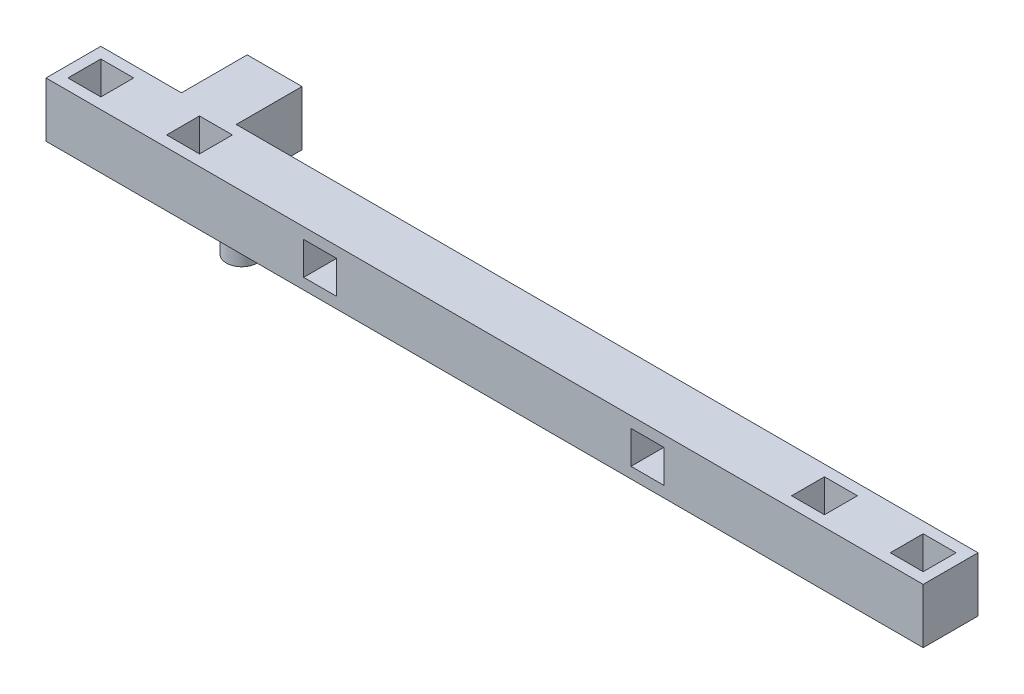
from build123d import *

# Parameters (mm, degrees)
SKETCH1_W           = 80
SKETCH1_H           = 5
SKETCH1_W_2         = 3
SKETCH1_H_2         = 3
BOSS_EXTRUDE1_DEPTH = 5
SKETCH2_W           = 3
SKETCH2_H           = 3
CUT_EXTRUDE1_DEPTH  = 5
SKETCH3_W           = 5
SKETCH3_H           = 5
BOSS_EXTRUDE2_DEPTH = 6
SKETCH4_R           = 1.4
BOSS_EXTRUDE3_DEPTH = 8


with BuildPart() as part:
    # Sketch1 → Boss-Extrude1 (new body)
    with BuildSketch(Plane.XY):
        with Locations((40, 2.5)):
            Rectangle(SKETCH1_W, SKETCH1_H)
        with Locations((54.85, 2.5)):
            Rectangle(SKETCH1_W_2, SKETCH1_H_2, mode=Mode.SUBTRACT)
        with Locations((25, 2.5)):
            Rectangle(SKETCH1_W_2, SKETCH1_H_2, mode=Mode.SUBTRACT)
    extrude(amount=BOSS_EXTRUDE1_DEPTH)

    # Sketch2 → Cut-Extrude1 (cut)
    with BuildSketch(Plane(origin=(0, 5, 0), x_dir=(1, 0, 0), z_dir=(0, 1, 0))):
        with Locations((77.5, -2.5)):
            Rectangle(SKETCH2_W, SKETCH2_H)
        with Locations((2.5, -2.5)):
            Rectangle(SKETCH2_W, SKETCH2_H)
        with Locations((11.5, -2.5)):
            Rectangle(SKETCH2_W, SKETCH2_H)
        with Locations((68.5, -2.5)):
            Rectangle(SKETCH2_W, SKETCH2_H)
    extrude(amount=-CUT_EXTRUDE1_DEPTH, mode=Mode.SUBTRACT)

    # Sketch3 → Boss-Extrude2 (add)
    with BuildSketch(Plane(origin=(0, 0, 0), x_dir=(-1, 0, 0), z_dir=(0, 0, -1))):
        with Locations((-9.85, 2.5)):
            Rectangle(SKETCH3_W, SKETCH3_H)
    extrude(amount=BOSS_EXTRUDE2_DEPTH)

    # Sketch4 → Boss-Extrude3 (add)
    with BuildSketch(Plane.XZ):
        with Locations(Location((9.85, -3, 0), (0, 0, 90))):
            Circle(SKETCH4_R)
    extrude(amount=BOSS_EXTRUDE3_DEPTH)


solid = part.part
